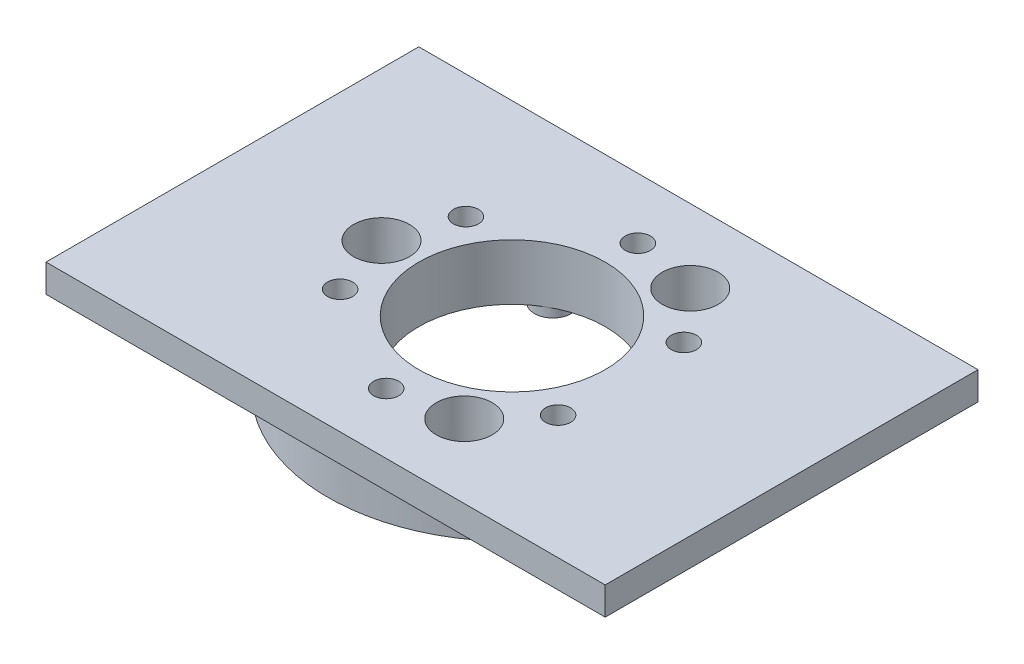
from build123d import *

# Parameters (mm, degrees)
SKETCH_1_R           = 19.75
SKETCH_1_R_2         = 18.77
EXTRUDE_1_DEPTH      = 1
SKETCH_2_R           = 19.75
EXTRUDE_2_DEPTH      = 6
SKETCH_5_R           = 1.35
SKETCH_5_R_2         = 10
CUT_EXTRUDE_2_DEPTH  = 29.567901568
SKETCH_6_R           = 1.98
EXTRUDE_4_DEPTH      = 1
EXTRUDE_START        = -3
SKETCH_11_W          = 60
SKETCH_11_H          = 40
SKETCH_11_R          = 19.75
EXTRUDE_6_DEPTH      = 3
SKETCH_7_R           = 3
CUT_EXTRUDE_7_DEPTH  = 20
EXTRUDE_7_DEPTH      = 1
EXTRUDE_7_DEPTH_BACK = 2


with BuildPart() as part:
    # 草图1 → 凸台-拉伸1 (new body)
    with BuildSketch(Plane(origin=(0, 0, 0), x_dir=(1, 0, 0), z_dir=(0, 1, 0))):
        with Locations(Location((0, 0, 0), (0, 0, 270))):
            Circle(SKETCH_1_R)
        with Locations(Location((0, 0, 0), (0, 0, 270))):
            Circle(SKETCH_1_R_2, mode=Mode.SUBTRACT)
    extrude(amount=EXTRUDE_1_DEPTH)

    # 草图2 → 凸台-拉伸2 (add)
    with BuildSketch(Plane(origin=(0, 1, 0), x_dir=(1, 0, 0), z_dir=(0, 1, 0))):
        with Locations(Location((0, 0, 0), (0, 0, 270))):
            Circle(SKETCH_2_R)
    extrude(amount=EXTRUDE_2_DEPTH)

    # 草图5 → 切除-拉伸2 (cut, through all)
    with BuildSketch(Plane.XZ.offset(-1)):
        with Locations(Location((0, 13.5, 0), (0, 0, 270))):
            Circle(SKETCH_5_R)
        with Locations(Location((11.691342951, 6.75, 0), (0, 0, 270))):
            Circle(SKETCH_5_R)
        with Locations(Location((11.691342951, -6.75, 0), (0, 0, 270))):
            Circle(SKETCH_5_R)
        with Locations(Location((0, -13.5, 0), (0, 0, 270))):
            Circle(SKETCH_5_R)
        with Locations(Location((-11.691342951, -6.75, 0), (0, 0, 270))):
            Circle(SKETCH_5_R)
        with Locations(Location((-11.691342951, 6.75, 0), (0, 0, 270))):
            Circle(SKETCH_5_R)
        with Locations(Location((0, 0, 0), (0, 0, 270))):
            Circle(SKETCH_5_R_2)
    extrude(amount=-CUT_EXTRUDE_2_DEPTH, mode=Mode.SUBTRACT)

    # 草图6 → 凸台-拉伸4 (add)
    with BuildSketch(Plane.XZ.offset(-1)):
        with Locations(Location((12, 0, 0), (0, 0, 90))):
            Circle(SKETCH_6_R)
        with Locations(Location((-6, -10.392304845, 0), (0, 0, 90))):
            Circle(SKETCH_6_R)
        with Locations(Location((-6, 10.392304845, 0), (0, 0, 90))):
            Circle(SKETCH_6_R)
    extrude(amount=EXTRUDE_4_DEPTH)

    # 草图11 → 凸台-拉伸6 (add)
    with BuildSketch(Plane(origin=(0, 7, 0), x_dir=(1, 0, 0), z_dir=(0, 1, 0)).offset(EXTRUDE_START)):
        Rectangle(SKETCH_11_W, SKETCH_11_H)
        with Locations(Location((0, 0, 0), (0, 0, 270))):
            Circle(SKETCH_11_R, mode=Mode.SUBTRACT)
    extrude(amount=EXTRUDE_6_DEPTH)

    # 草图7 → 切除-拉伸7 (cut)
    with BuildSketch(Plane.XZ.offset(-1)):
        with Locations(Location((-14, 0, 0), (0, 0, 270))):
            Circle(SKETCH_7_R)
        with Locations(Location((7, 12.124355653, 0), (0, 0, 270))):
            Circle(SKETCH_7_R)
        with Locations(Location((7, -12.124355653, 0), (0, 0, 270))):
            Circle(SKETCH_7_R)
    extrude(amount=-CUT_EXTRUDE_7_DEPTH, mode=Mode.SUBTRACT)

    # 草图15 → 凸台-拉伸7 (add, two sides: drawn at the far end of the back side and taken through both)
    with BuildSketch(Plane(origin=(0, 1, 0), x_dir=(-1, 0, 0), z_dir=(0, -1, 0)).offset(-EXTRUDE_7_DEPTH_BACK)):
        with BuildLine():
            Line((-5.518906371, 18.541790589), (-5.99084035, 20.127340408))
            ThreePointArc((-5.99084035, 20.127340408), (0, 21), (5.99084035, 20.127340408))
            Line((5.99084035, 20.127340408), (5.518906371, 18.541790589))
            ThreePointArc((5.518906371, 18.541790589), (0, 19.345705616), (-5.518906371, 18.541790589))
        make_face()
    extrude(amount=EXTRUDE_7_DEPTH + EXTRUDE_7_DEPTH_BACK)


solid = part.part
